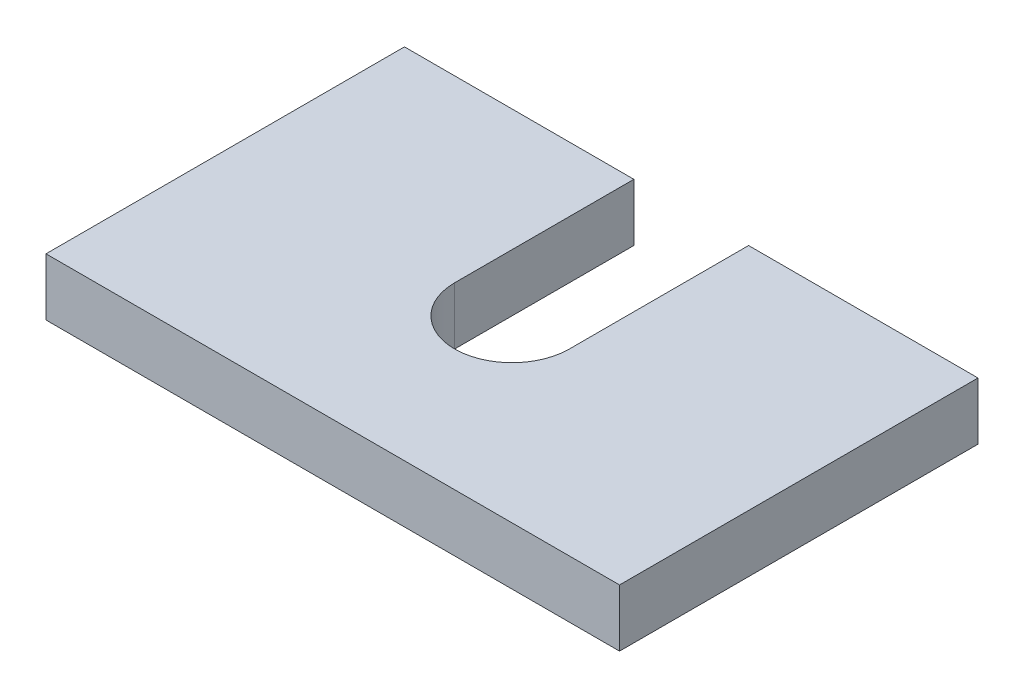
from build123d import *

# Parameters (mm, degrees)
BOSS_EXTRUDE1_DEPTH = 4


with BuildPart() as part:
    # Sketch1 → Boss-Extrude1 (new body)
    with BuildSketch(Plane(origin=(0, 0, 0), x_dir=(1, 0, 0), z_dir=(0, 1, 0))):
        with BuildLine():
            Line((-4, 0), (-4, 12.5))
            Line((-4, 12.5), (-20, 12.5))
            Line((-20, 12.5), (-20, -12.5))
            Line((-20, -12.5), (20, -12.5))
            Line((20, -12.5), (20, 12.5))
            Line((20, 12.5), (4, 12.5))
            Line((4, 12.5), (4, 0))
            ThreePointArc((4, 0), (0, -4), (-4, 0))
        make_face()
    extrude(amount=BOSS_EXTRUDE1_DEPTH)


solid = part.part
